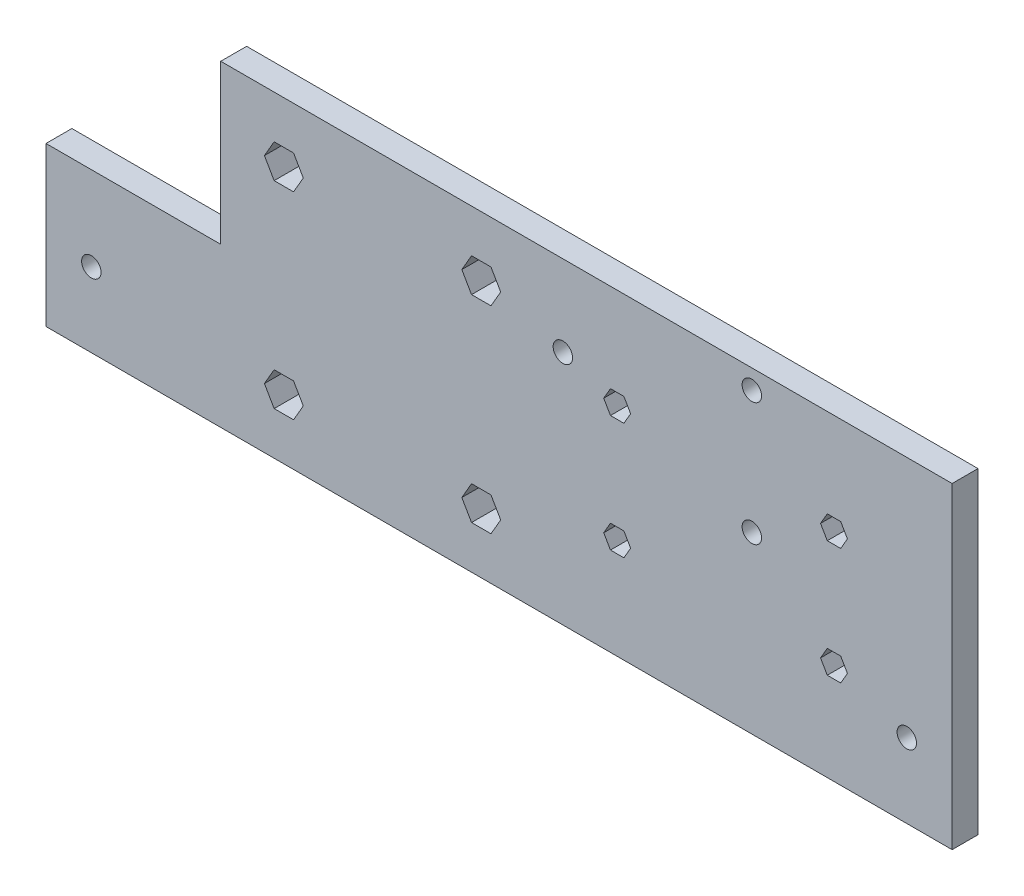
from build123d import *

# Parameters (mm, degrees)
BOSS_EXTRUDE1_DEPTH = 4
SKETCH2_R           = 1.5
CUT_EXTRUDE1_DEPTH  = 4
CUT_EXTRUDE5_DEPTH  = 34
CUT_EXTRUDE6_DEPTH  = 34
SKETCH6_R           = 1.5
CUT_EXTRUDE7_DEPTH  = 10


with BuildPart() as part:
    # Sketch1 → Boss-Extrude1 (new body)
    with BuildSketch(Plane.XY):
        Polygon((0, 0), (-40, 0), (-40, 24.5), (-13, 24.5), (-13, 49), (100, 49), (100, 0), align=None)
    extrude(amount=BOSS_EXTRUDE1_DEPTH)

    # Sketch2 → Cut-Extrude1 (cut)
    with BuildSketch(Plane.XY.offset(4)):
        with Locations((39.857429038, 36.5)):
            Circle(SKETCH2_R)
        with Locations((69.057429038, 27)):
            Circle(SKETCH2_R)
        with Locations((69.057429038, 46)):
            Circle(SKETCH2_R)
    extrude(amount=-CUT_EXTRUDE1_DEPTH, mode=Mode.SUBTRACT)

    # Sketch4 → Cut-Extrude5 (cut)
    with BuildSketch(Plane(origin=(0, 0, -4), x_dir=(-1, 0, 0), z_dir=(0, 0, -1))):
        Polygon((-80.710769515, 31.7), (-79.671539031, 33.5), (-80.710769515, 35.3), (-82.789230485, 35.3), (-83.828460969, 33.5), (-82.789230485, 31.7), align=None)
        Polygon((-47.210769515, 31.7), (-46.171539031, 33.5), (-47.210769515, 35.3), (-49.289230485, 35.3), (-50.328460969, 33.5), (-49.289230485, 31.7), align=None)
        Polygon((-47.210769515, 13.7), (-46.171539031, 15.5), (-47.210769515, 17.3), (-49.289230485, 17.3), (-50.328460969, 15.5), (-49.289230485, 13.7), align=None)
        Polygon((-80.710769515, 13.7), (-79.671539031, 15.5), (-80.710769515, 17.3), (-82.789230485, 17.3), (-83.828460969, 15.5), (-82.789230485, 13.7), align=None)
    extrude(amount=-CUT_EXTRUDE5_DEPTH, mode=Mode.SUBTRACT)

    # Sketch5 → Cut-Extrude6 (cut)
    with BuildSketch(Plane(origin=(0, 0, 0), x_dir=(-1, 0, 0), z_dir=(0, 0, -1))):
        Polygon((4.7511107, 37.15), (6.2522214, 39.75), (4.7511107, 42.35), (1.7488893, 42.35), (0.2477786, 39.75), (1.7488893, 37.15), align=None)
        Polygon((-25.7488893, 37.15), (-24.2477786, 39.75), (-25.7488893, 42.35), (-28.7511107, 42.35), (-30.2522214, 39.75), (-28.7511107, 37.15), align=None)
        Polygon((-25.7488893, 6.65), (-24.2477786, 9.25), (-25.7488893, 11.85), (-28.7511107, 11.85), (-30.2522214, 9.25), (-28.7511107, 6.65), align=None)
        Polygon((4.7511107, 6.65), (6.2522214, 9.25), (4.7511107, 11.85), (1.7488893, 11.85), (0.2477786, 9.25), (1.7488893, 6.65), align=None)
    extrude(amount=-CUT_EXTRUDE6_DEPTH, mode=Mode.SUBTRACT)

    # Sketch6 → Cut-Extrude7 (cut)
    with BuildSketch(Plane.XY.offset(4)):
        with Locations((-33, 11.5)):
            Circle(SKETCH6_R)
        with Locations((93, 11.5)):
            Circle(SKETCH6_R)
    extrude(amount=-CUT_EXTRUDE7_DEPTH, mode=Mode.SUBTRACT)


solid = part.part
